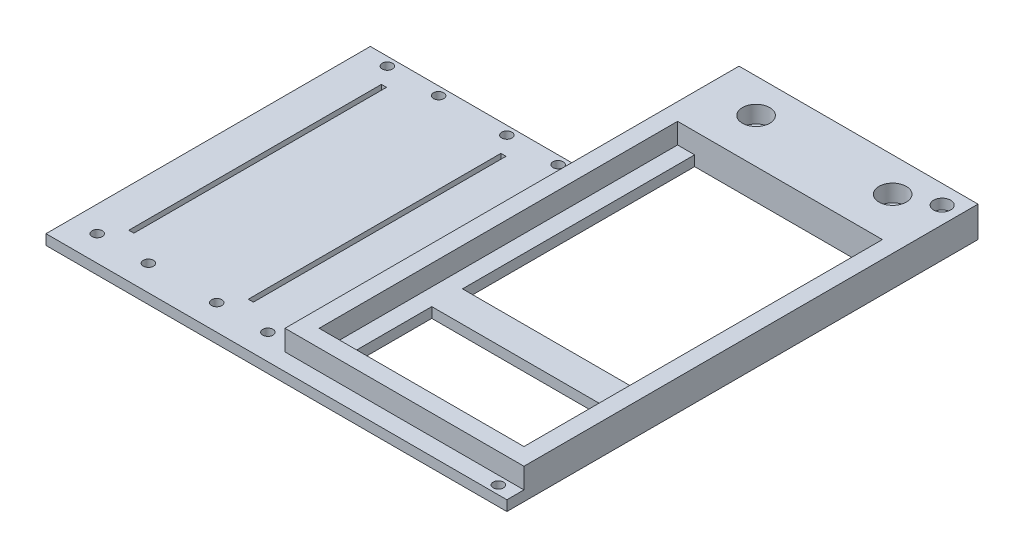
from build123d import *

# Parameters (mm, degrees)
SKETCH1_W           = 70
SKETCH1_H           = 130
SKETCH1_W_2         = 60
SKETCH1_H_2         = 105
BOSS_EXTRUDE1_DEPTH = 9
SKETCH1_3_W         = 50
SKETCH1_3_H         = 23
SKETCH1_3_W_2       = 65
SKETCH1_3_H_2       = 90
SKETCH1_3_R         = 1.5
SKETCH1_3_W_3       = 1.5
SKETCH1_3_H_3       = 74
SKETCH1_3_W_4       = 5
SKETCH1_3_H_4       = 10
BOSS_EXTRUDE2_DEPTH = 3
SKETCH2_R           = 1.5
BOSS_EXTRUDE3_DEPTH = 3
SKETCH3_R           = 4
CUT_EXTRUDE1_DEPTH  = 5
SKETCH3_3_R         = 1.5
CUT_EXTRUDE2_DEPTH  = 20
SKETCH4_W           = 70
SKETCH4_H           = 9
BOSS_EXTRUDE4_DEPTH = 3
SKETCH3_6_R         = 1.5
CUT_EXTRUDE5_DEPTH  = 3


with BuildPart() as part:
    # Sketch1 → Boss-Extrude1 (new body)
    with BuildSketch(Plane(origin=(0, 0, 0), x_dir=(1, 0, 0), z_dir=(0, 1, 0))):
        Rectangle(SKETCH1_W, SKETCH1_H)
        with Locations((0, -7.5)):
            Rectangle(SKETCH1_W_2, SKETCH1_H_2, mode=Mode.SUBTRACT)
    extrude(amount=BOSS_EXTRUDE1_DEPTH)

    # Sketch1<3> → Boss-Extrude2 (add)
    # profile 1 of 3: a face of its own
    with BuildSketch(Plane(origin=(0, 0, 0), x_dir=(1, 0, 0), z_dir=(0, 1, 0))):
        Polygon((-30, 45), (-30, -60), (30, -60), (30, 45), (25, 45), (25, -23), (-25, -23), (-25, 45), align=None)
        with Locations((0, -43.5)):
            Rectangle(SKETCH1_3_W, SKETCH1_3_H, mode=Mode.SUBTRACT)
    # profile 2 of 3: a face of its own
    with BuildSketch(Plane(origin=(0, 0, 0), x_dir=(1, 0, 0), z_dir=(0, 1, 0))):
        with Locations((-67.5, -20)):
            Rectangle(SKETCH1_3_W_2, SKETCH1_3_H_2)
        with Locations((-42.5, 22.5)):
            Circle(SKETCH1_3_R, mode=Mode.SUBTRACT)
        with Locations((-57.5, -62.5)):
            Circle(SKETCH1_3_R, mode=Mode.SUBTRACT)
        with Locations((-42.5, -62.5)):
            Circle(SKETCH1_3_R, mode=Mode.SUBTRACT)
        with Locations((-53, -20)):
            Rectangle(SKETCH1_3_W_3, SKETCH1_3_H_3, mode=Mode.SUBTRACT)
        with Locations((-57.5, 22.5)):
            Circle(SKETCH1_3_R, mode=Mode.SUBTRACT)
        with Locations((-77.5, 22.5)):
            Circle(SKETCH1_3_R, mode=Mode.SUBTRACT)
        with Locations((-92.5, -62.5)):
            Circle(SKETCH1_3_R, mode=Mode.SUBTRACT)
        with Locations((-77.5, -62.5)):
            Circle(SKETCH1_3_R, mode=Mode.SUBTRACT)
        with Locations((-88, -20)):
            Rectangle(SKETCH1_3_W_3, SKETCH1_3_H_3, mode=Mode.SUBTRACT)
        with Locations((-92.5, 22.5)):
            Circle(SKETCH1_3_R, mode=Mode.SUBTRACT)
    # profile 3 of 3: a face of its own
    with BuildSketch(Plane(origin=(0, 0, 0), x_dir=(1, 0, 0), z_dir=(0, 1, 0))):
        with Locations((27.5, 60)):
            Rectangle(SKETCH1_3_W_4, SKETCH1_3_H_4)
    extrude(amount=BOSS_EXTRUDE2_DEPTH)

    # Sketch2 → Boss-Extrude3 (add)
    with BuildSketch(Plane(origin=(0, 0, 0), x_dir=(1, 0, 0), z_dir=(0, 1, 0))):
        Polygon((35, -65), (-35, -65), (-100, -65), (-100, -70), (35, -70), align=None)
        with Locations((30, -67.5)):
            Circle(SKETCH2_R, mode=Mode.SUBTRACT)
    extrude(amount=BOSS_EXTRUDE3_DEPTH)

    # Sketch3 → Cut-Extrude1 (cut)
    with BuildSketch(Plane(origin=(0, 9, 0), x_dir=(1, 0, 0), z_dir=(0, 1, 0))):
        with Locations((-20, 58)):
            Circle(SKETCH3_R)
        with Locations((20, 58)):
            Circle(SKETCH3_R)
    extrude(amount=-CUT_EXTRUDE1_DEPTH, mode=Mode.SUBTRACT)

    # Sketch3<3> → Cut-Extrude2 (cut)
    with BuildSketch(Plane(origin=(0, 9, 0), x_dir=(1, 0, 0), z_dir=(0, 1, 0))):
        with Locations((30, 62.5)):
            Circle(SKETCH3_3_R)
    extrude(amount=-CUT_EXTRUDE2_DEPTH, mode=Mode.SUBTRACT)

    # Sketch4 → Boss-Extrude4 (add)
    with BuildSketch(Plane(origin=(0, 0, -65), x_dir=(-1, 0, 0), z_dir=(0, 0, -1))):
        with Locations((0, 4.5)):
            Rectangle(SKETCH4_W, SKETCH4_H)
    extrude(amount=BOSS_EXTRUDE4_DEPTH)

    # Sketch3<6> → Cut-Extrude5 (cut)
    with BuildSketch(Plane(origin=(0, 9, 0), x_dir=(1, 0, 0), z_dir=(0, 1, 0))):
        with BuildLine():
            ThreePointArc((32.5, 62.5), (31.767766969, 64.267766937), (30.000000046, 65))
            ThreePointArc((30.000000046, 65), (27.5, 62.500000023), (30, 60))
            ThreePointArc((30, 60), (31.767766953, 60.732233047), (32.5, 62.5))
        make_face()
        with Locations((30, 62.5)):
            Circle(SKETCH3_6_R, mode=Mode.SUBTRACT)
    extrude(amount=-CUT_EXTRUDE5_DEPTH, mode=Mode.SUBTRACT)


solid = part.part
